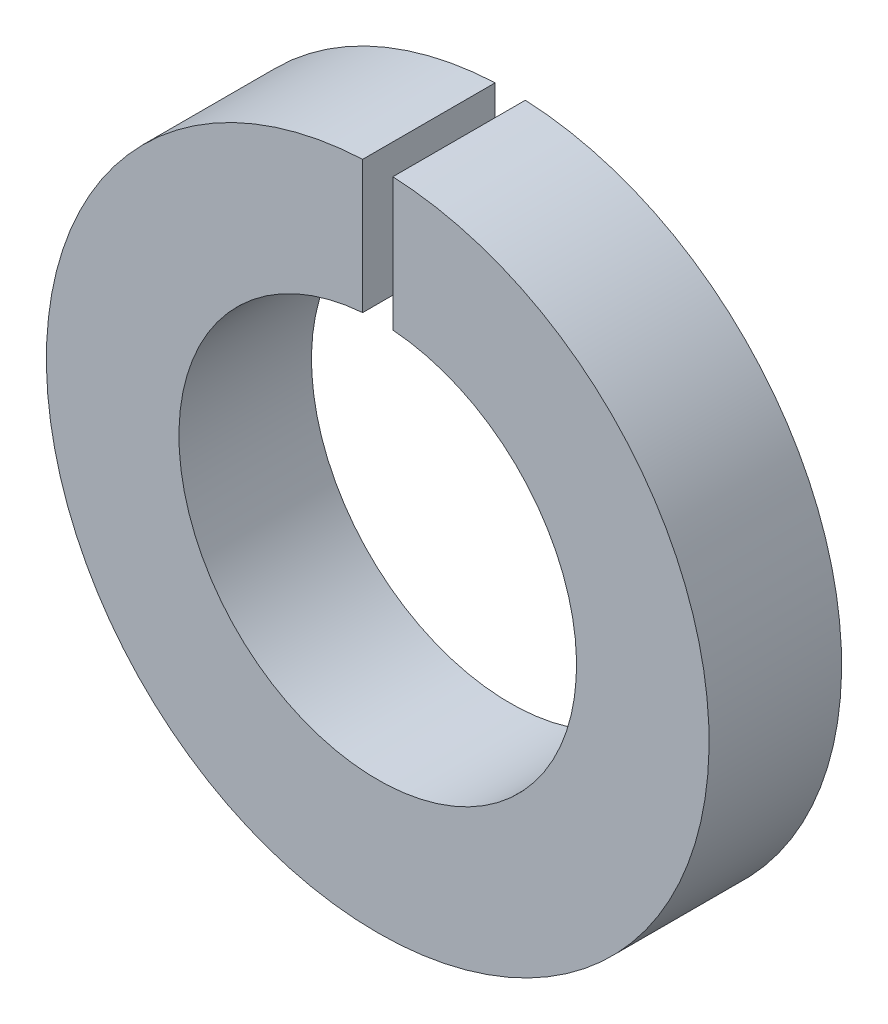
from build123d import *

# Parameters (mm, degrees)
SKETCH1_R           = 1.75
SKETCH1_R_2         = 1.05
BOSS_EXTRUDE1_DEPTH = 0.7
CUT_EXTRUDE1_START  = -1
CUT_EXTRUDE1_DEPTH  = 1


with BuildPart() as part:
    # Sketch1 → Boss-Extrude1 (new body)
    with BuildSketch(Plane.XY):
        Circle(SKETCH1_R)
        Circle(SKETCH1_R_2, mode=Mode.SUBTRACT)
    extrude(amount=BOSS_EXTRUDE1_DEPTH)

    # Sketch2 → Cut-Extrude1 (cut)
    with BuildSketch(Plane.XY.offset(0.7).offset(CUT_EXTRUDE1_START)):
        with BuildLine():
            Line((-0.07962457, 1.748187612), (-0.07962457, 1.046976565))
            ThreePointArc((-0.07962457, 1.046976565), (0, 1.05), (0.07962457, 1.046976565))
            Line((0.07962457, 1.046976565), (0.07962457, 1.748187612))
            ThreePointArc((0.07962457, 1.748187612), (0, 1.75), (-0.07962457, 1.748187612))
        make_face()
    extrude(amount=CUT_EXTRUDE1_DEPTH, mode=Mode.SUBTRACT)


solid = part.part
